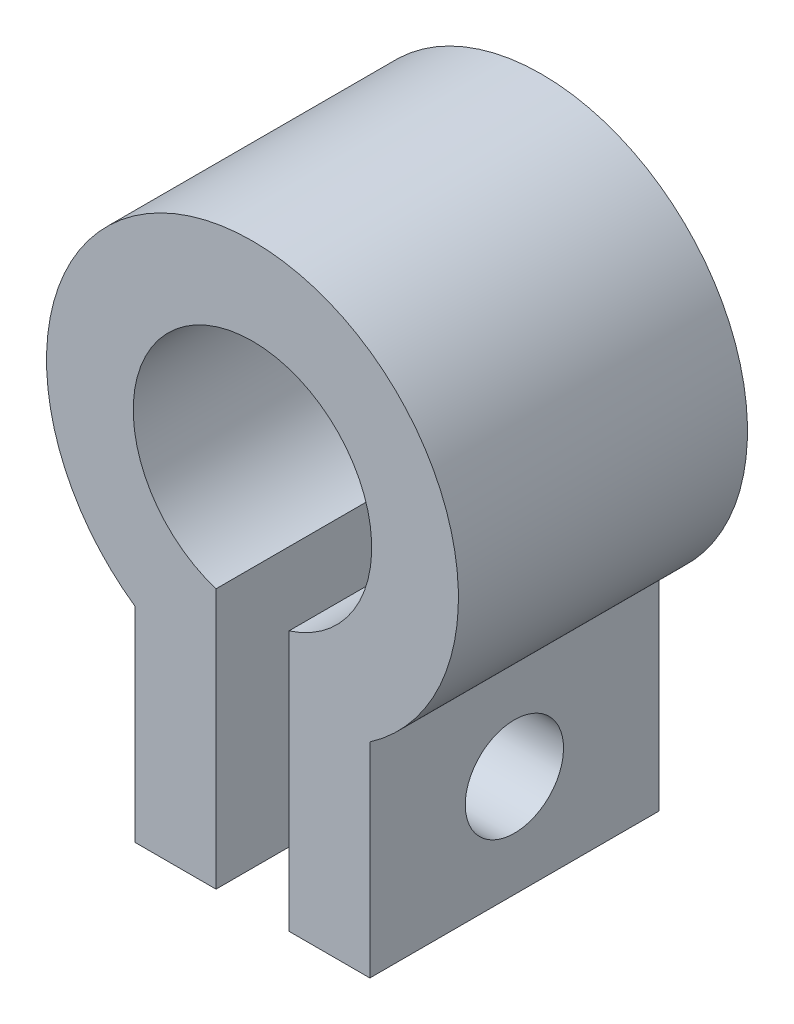
from build123d import *

# Parameters (mm, degrees)
BOSS_EXTRUDE1_DEPTH = 10
SKETCH2_R           = 1.7
CUT_EXTRUDE1_DEPTH  = 20.805330599


with BuildPart() as part:
    # Sketch1 → Boss-Extrude1 (new body)
    with BuildSketch(Plane.XY):
        with BuildLine():
            Line((4.06124537, -3.927452752), (4.06124537, -5.854221643))
            ThreePointArc((4.06124537, -5.854221643), (6.312764777, -3.303729085), (7.125, 0))
            ThreePointArc((7.125, 0), (-3.303729085, 6.312764777), (-4.06124537, -5.854221643))
            Line((-4.06124537, -5.854221643), (-4.06124537, -3.927452752))
            Line((-4.06124537, -3.927452752), (-1.26124537, -3.927452752))
            ThreePointArc((-1.26124537, -3.927452752), (-2.430327946, 3.333036315), (4.125, 0))
            ThreePointArc((4.125, 0), (3.333036315, -2.430327946), (1.26124537, -3.927452752))
            Line((1.26124537, -3.927452752), (4.06124537, -3.927452752))
        make_face()
        with BuildLine():
            ThreePointArc((-4.06124537, -5.854221643), (-2.723530413, -6.583920343), (-1.26124537, -7.012480668))
            Line((-1.26124537, -7.012480668), (-1.26124537, -3.927452752))
            Line((-1.26124537, -3.927452752), (-4.06124537, -3.927452752))
            Line((-4.06124537, -3.927452752), (-4.06124537, -5.854221643))
        make_face()
        with BuildLine():
            Line((1.26124537, -3.927452752), (1.26124537, -7.012480668))
            ThreePointArc((1.26124537, -7.012480668), (2.723530413, -6.583920343), (4.06124537, -5.854221643))
            Line((4.06124537, -5.854221643), (4.06124537, -3.927452752))
            Line((4.06124537, -3.927452752), (1.26124537, -3.927452752))
        make_face()
        with BuildLine():
            Line((1.26124537, -7.012480668), (1.26124537, -12.927452752))
            Line((1.26124537, -12.927452752), (4.06124537, -12.927452752))
            Line((4.06124537, -12.927452752), (4.06124537, -5.854221643))
            ThreePointArc((4.06124537, -5.854221643), (2.723530413, -6.583920343), (1.26124537, -7.012480668))
        make_face()
        with BuildLine():
            Line((-1.26124537, -12.927452752), (-1.26124537, -7.012480668))
            ThreePointArc((-1.26124537, -7.012480668), (-2.723530413, -6.583920343), (-4.06124537, -5.854221643))
            Line((-4.06124537, -5.854221643), (-4.06124537, -12.927452752))
            Line((-4.06124537, -12.927452752), (-1.26124537, -12.927452752))
        make_face()
    extrude(amount=BOSS_EXTRUDE1_DEPTH)

    # Sketch2 → Cut-Extrude1 (cut, through all)
    with BuildSketch(Plane.ZY.offset(4.06124537)):
        with Locations(Location((5, -9.390837197, 0), (0, 0, 270))):
            Circle(SKETCH2_R)
    extrude(amount=-CUT_EXTRUDE1_DEPTH, mode=Mode.SUBTRACT)


solid = part.part
